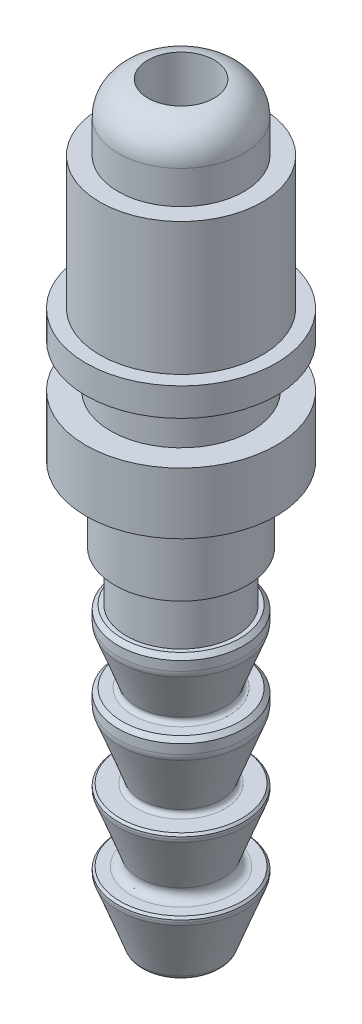
from build123d import *

# Parameters (mm, degrees)
SKETCH1_R           = 5.75
BOSS_EXTRUDE1_DEPTH = 16
SKETCH2_OUTSIDE_W   = 18.062
SKETCH2_OUTSIDE_H   = 18.062
SKETCH2_OUTSIDE_R   = 4.9
CUT_EXTRUDE1_DEPTH  = 8
SKETCH3_R           = 3.8
BOSS_EXTRUDE2_DEPTH = 4
FILLET2_R           = 2
SKETCH4_R           = 4
BOSS_EXTRUDE3_DEPTH = 4.5
SKETCH5_R           = 3.3
BOSS_EXTRUDE4_DEPTH = 3
BOSS_EXTRUDE5_START = 1
SKETCH6_R           = 3.8
BOSS_EXTRUDE5_DEPTH = 1
BOSS_EXTRUDE6_REACH = 35.502
SKETCH10_R          = 3.8
LPATTERN1_COUNT     = 4
LPATTERN1_PITCH     = 4.35
CHAMFER1_SIZE       = 0.25
CHAMFER2_SIZE       = 0.25
CHAMFER3_SIZE       = 0.125
CHAMFER4_SIZE       = 0.125
FILLET3_R           = 0.5
FILLET4_R           = 1
FILLET5_R           = 0.25
FILLET6_R           = 0.5
FILLET7_R           = 0.5
SKETCH12_W          = 1.5
SKETCH12_H          = 2.6
SKETCH13_R          = 2
CUT_EXTRUDE2_DEPTH  = 47.270157769


with BuildPart() as part:
    # Sketch1 → Boss-Extrude1 (new body)
    with BuildSketch(Plane(origin=(0, 0, 0), x_dir=(1, 0, 0), z_dir=(0, 1, 0))):
        with Locations(Location((0, 0, 0), (0, 0, 270))):
            Circle(SKETCH1_R)
    extrude(amount=BOSS_EXTRUDE1_DEPTH)

    # Sketch2 outside → Cut-Extrude1 (cut)
    with BuildSketch(Plane(origin=(0, 16, 0), x_dir=(1, 0, 0), z_dir=(0, 1, 0))):
        Rectangle(SKETCH2_OUTSIDE_W, SKETCH2_OUTSIDE_H)
        with Locations(Location((0, 0, 0), (0, 0, 270))):
            Circle(SKETCH2_OUTSIDE_R, mode=Mode.SUBTRACT)
    extrude(amount=-CUT_EXTRUDE1_DEPTH, mode=Mode.SUBTRACT)

    # Sketch3 → Boss-Extrude2 (add)
    with BuildSketch(Plane(origin=(0, 16, 0), x_dir=(1, 0, 0), z_dir=(0, 1, 0))):
        with Locations(Location((0, 0, 0), (0, 0, 270))):
            Circle(SKETCH3_R)
    extrude(amount=BOSS_EXTRUDE2_DEPTH)

    # Fillet2
    fillet2_edges = [part.edges().sort_by_distance(p)[0] for p in [
        (0, 20, -3.8),
    ]]
    fillet(fillet2_edges, radius=FILLET2_R)

    # Sketch4 → Boss-Extrude3 (add)
    with BuildSketch(Plane.XZ):
        with Locations(Location((0, 0, 0), (0, 0, 270))):
            Circle(SKETCH4_R)
    extrude(amount=BOSS_EXTRUDE3_DEPTH)

    # Sketch5 → Boss-Extrude4 (add)
    with BuildSketch(Plane.XZ.offset(4.5)):
        with Locations(Location((0, 0, 0), (0, 0, 270))):
            Circle(SKETCH5_R)
    extrude(amount=BOSS_EXTRUDE4_DEPTH)

    # Sketch6 → Boss-Extrude5 (add)
    with BuildSketch(Plane.XZ.offset(7.5).offset(BOSS_EXTRUDE5_START)):
        with Locations(Location((0, 0, 0), (0, 0, 90))):
            Circle(SKETCH6_R)
    boss_extrude5 = extrude(amount=-BOSS_EXTRUDE5_DEPTH)

    # Sketch10 → Boss-Extrude6 (add, up to next)
    with BuildSketch(Plane(origin=(0, -12.5, 0), x_dir=(-1, 0, 0), z_dir=(0, -1, 0)), mode=Mode.PRIVATE) as boss_extrude6_sk1:
        with Locations(Location((0, 0, 0), (0, 0, 270))):
            Circle(SKETCH10_R)
    boss_extrude6_tool1 = extrude(boss_extrude6_sk1.sketch, amount=-BOSS_EXTRUDE6_REACH, mode=Mode.PRIVATE) - part.part
    boss_extrude6 = boss_extrude6_tool1.solids().sort_by_distance((0, -12.5, 0))[0]
    add(boss_extrude6)

    # Sketch11 → Cut-Revolve1 (revolve, cut)
    with BuildSketch(Plane.XY, mode=Mode.PRIVATE) as cut_revolve1_sk:
        Polygon((-2.3, -12.5), (-3.8, -8.5), (-3.8, -12.5), align=None)
    cut_revolve1 = revolve(cut_revolve1_sk.sketch.rotate(Axis((0, 8, 0), (0, -1, 0)), 270), axis=Axis((0, 8, 0), (0, -1, 0)), mode=Mode.SUBTRACT)

    # LPattern1: Boss-Extrude5, Boss-Extrude6, Cut-Revolve1 ×4
    with Locations(*[(0, -i * LPATTERN1_PITCH, 0) for i in range(1, LPATTERN1_COUNT)]):
        add(boss_extrude5)
        add(boss_extrude6)
        add(cut_revolve1, mode=Mode.SUBTRACT)

    # Chamfer1
    chamfer1_edges = [part.edges().sort_by_distance(p)[0] for p in [
        (0, -7.5, -3.8),
    ]]
    chamfer(chamfer1_edges, length=CHAMFER1_SIZE)

    # Chamfer2
    chamfer2_edges = [part.edges().sort_by_distance(p)[0] for p in [
        (0, -11.85, -3.8),
    ]]
    chamfer(chamfer2_edges, length=CHAMFER2_SIZE)

    # Chamfer3
    chamfer3_edges = [part.edges().sort_by_distance(p)[0] for p in [
        (0, -16.85, -3.8),
    ]]
    chamfer(chamfer3_edges, length=CHAMFER3_SIZE)

    # Chamfer4
    chamfer4_edges = [part.edges().sort_by_distance(p)[0] for p in [
        (0, -21.2, -3.8),
    ]]
    chamfer(chamfer4_edges, length=CHAMFER4_SIZE)

    # Fillet3
    fillet3_edges = [part.edges().sort_by_distance(p)[0] for p in [
        (0, -17.2, -3.8),
        (0, -21.55, -3.8),
    ]]
    fillet(fillet3_edges, radius=FILLET3_R)

    # Fillet4
    fillet4_edges = [part.edges().sort_by_distance(p)[0] for p in [
        (0, -8.5, -3.8),
        (0, -12.85, -3.8),
    ]]
    fillet(fillet4_edges, radius=FILLET4_R)

    # Fillet5
    fillet5_edges = [part.edges().sort_by_distance(p)[0] for p in [
        (0, -11.85, -2.54375),
        (0, -16.85, -2.3),
    ]]
    fillet(fillet5_edges, radius=FILLET5_R)

    # Fillet6
    fillet6_edges = [part.edges().sort_by_distance(p)[0] for p in [
        (0, -21.2, -2.3),
    ]]
    fillet(fillet6_edges, radius=FILLET6_R)

    # Fillet7
    fillet7_edges = [part.edges().sort_by_distance(p)[0] for p in [
        (0, -25.55, -2.3),
    ]]
    fillet(fillet7_edges, radius=FILLET7_R)

    # Sketch12 → Cut-Revolve2 (revolve, cut)
    with BuildSketch(Plane(origin=(0, 0, 0), x_dir=(0, 0, -1), z_dir=(1, 0, 0)), mode=Mode.PRIVATE) as cut_revolve2_sk:
        with Locations((-5, 5)):
            Rectangle(SKETCH12_W, SKETCH12_H)
    revolve(cut_revolve2_sk.sketch.rotate(Axis((0, 8, 0), (0, -1, 0)), 180), axis=Axis((0, 8, 0), (0, -1, 0)), mode=Mode.SUBTRACT)

    # Sketch13 → Cut-Extrude2 (cut, through all)
    with BuildSketch(Plane.XZ.offset(25.55)):
        with Locations(Location((0, 0, 0), (0, 0, 270))):
            Circle(SKETCH13_R)
    extrude(amount=-CUT_EXTRUDE2_DEPTH, mode=Mode.SUBTRACT)


solid = part.part
